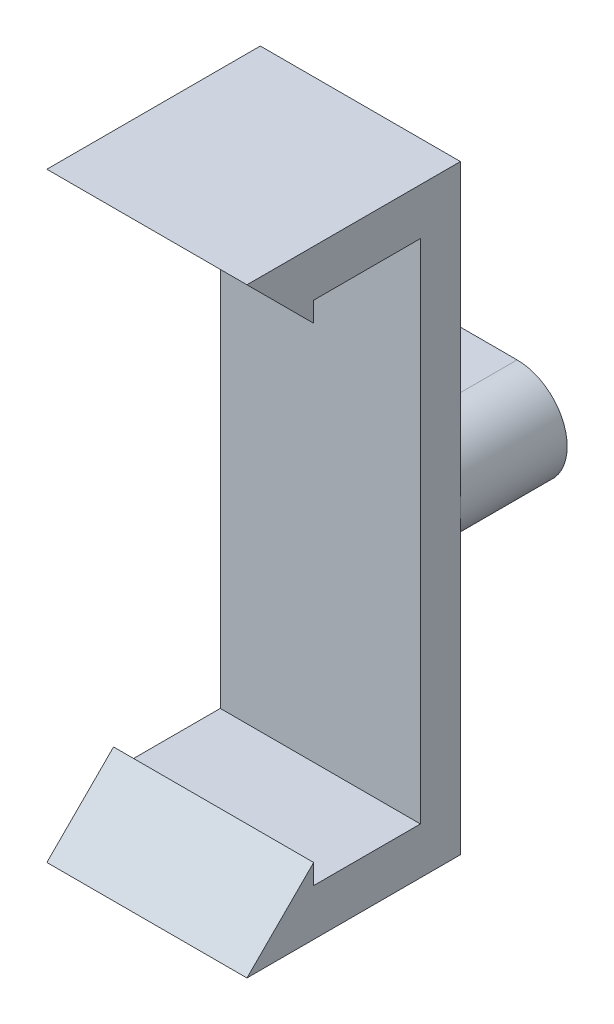
from build123d import *

# Parameters (mm, degrees)
IZIM2_W                     = 6
IZIM2_H                     = 18
Y_KSEKLIK_EKSTR_ZYON1_DEPTH = 1.2
IZIM3_W                     = 6
IZIM3_H                     = 1.4
Y_KSEKLIK_EKSTR_ZYON4_DEPTH = 3.2
IZIM6_W                     = 6
IZIM6_H                     = 2
Y_KSEKLIK_EKSTR_ZYON5_DEPTH = 2
KES_EKSTR_ZYON2_DEPTH       = 6
IZIM8_W                     = 6
IZIM8_H                     = 2
Y_KSEKLIK_EKSTR_ZYON6_DEPTH = 2
KES_EKSTR_ZYON3_DEPTH       = 6
Y_KSEKLIK_EKSTR_ZYON8_DEPTH = 3.2
IZIM12_R                    = 0.75
KES_EKSTR_ZYON4_DEPTH       = 4


with BuildPart() as part:
    # Çizim2 → Yükseklik-Ekstrüzyon1 (new body)
    with BuildSketch(Plane.XY):
        Rectangle(IZIM2_W, IZIM2_H)
    extrude(amount=Y_KSEKLIK_EKSTR_ZYON1_DEPTH)

    # Çizim3 → Yükseklik-Ekstrüzyon4 (add)
    with BuildSketch(Plane.XY.offset(1.2)):
        with Locations((0, 8.3)):
            Rectangle(IZIM3_W, IZIM3_H)
        with Locations((0, -8.3)):
            Rectangle(IZIM3_W, IZIM3_H)
    extrude(amount=Y_KSEKLIK_EKSTR_ZYON4_DEPTH)

    # Çizim6 → Yükseklik-Ekstrüzyon5 (add)
    with BuildSketch(Plane.XY.offset(4.4)):
        with Locations((0, 8)):
            Rectangle(IZIM6_W, IZIM6_H)
    extrude(amount=Y_KSEKLIK_EKSTR_ZYON5_DEPTH)

    # Çizim7 → Kes-Ekstrüzyon2 (cut)
    with BuildSketch(Plane(origin=(3, 0, 0), x_dir=(0, 0, -1), z_dir=(1, 0, 0))):
        Polygon((-6.4, 9), (-4.4, 7), (-6.4, 7), align=None)
    extrude(amount=-KES_EKSTR_ZYON2_DEPTH, mode=Mode.SUBTRACT)

    # Çizim8 → Yükseklik-Ekstrüzyon6 (add)
    with BuildSketch(Plane.XY.offset(4.4)):
        with Locations((0, -8)):
            Rectangle(IZIM8_W, IZIM8_H)
    extrude(amount=Y_KSEKLIK_EKSTR_ZYON6_DEPTH)

    # Çizim9 → Kes-Ekstrüzyon3 (cut)
    with BuildSketch(Plane.ZY.offset(3)):
        Polygon((6.4, -9), (4.4, -7), (6.4, -7), align=None)
    extrude(amount=-KES_EKSTR_ZYON3_DEPTH, mode=Mode.SUBTRACT)

    # Çizim10 → Yükseklik-Ekstrüzyon8 (add)
    with BuildSketch(Plane(origin=(0, 0, 0), x_dir=(-1, 0, 0), z_dir=(0, 0, -1))):
        with BuildLine():
            Line((1.5, 1.5), (-1.5, 1.5))
            ThreePointArc((-1.5, 1.5), (-3, 0), (-1.5, -1.5))
            Line((-1.5, -1.5), (1.5, -1.5))
            ThreePointArc((1.5, -1.5), (3, 0), (1.5, 1.5))
        make_face()
    extrude(amount=Y_KSEKLIK_EKSTR_ZYON8_DEPTH)

    # Çizim12 → Kes-Ekstrüzyon4 (cut)
    with BuildSketch(Plane(origin=(0, 0, -3.2), x_dir=(-1, 0, 0), z_dir=(0, 0, -1))):
        Circle(IZIM12_R)
    extrude(amount=-KES_EKSTR_ZYON4_DEPTH, mode=Mode.SUBTRACT)


solid = part.part
